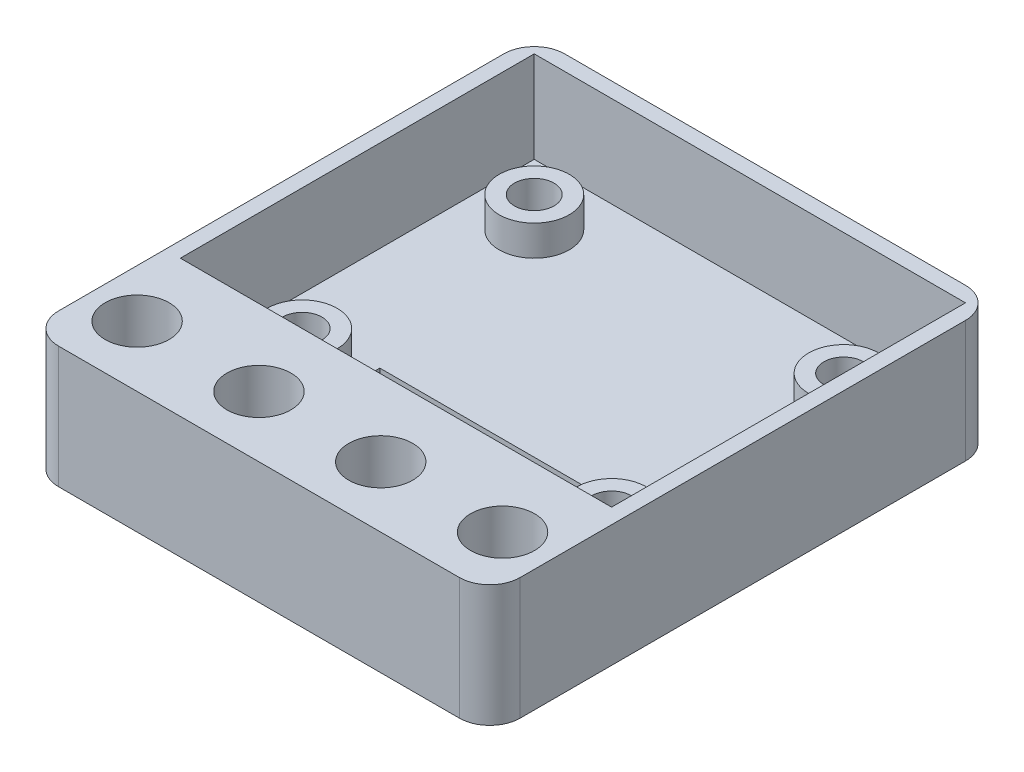
from build123d import *

# Parameters (mm, degrees)
SKETCH1_W           = 28.32
SKETCH1_H           = 23.24
SKETCH1_R           = 2.3
SKETCH1_W_2         = 14.72
SKETCH1_H_2         = 4.6
BOSS_EXTRUDE1_DEPTH = 2
SKETCH1_3_R         = 2.3
SKETCH1_3_R_2       = 1.3
BOSS_EXTRUDE2_DEPTH = 4
SKETCH1_4_R         = 2.1
SKETCH1_4_W         = 28.32
SKETCH1_4_H         = 23.24
BOSS_EXTRUDE3_DEPTH = 8
FILLET2_R           = 2


with BuildPart() as part:
    # Sketch1 → Boss-Extrude1 (new body)
    with BuildSketch(Plane(origin=(0, 0, 0), x_dir=(1, 0, 0), z_dir=(0, 1, 0))):
        Rectangle(SKETCH1_W, SKETCH1_H)
        with Locations((-10.16, -7.62)):
            Circle(SKETCH1_R, mode=Mode.SUBTRACT)
        with Locations((0, -7.62)):
            Rectangle(SKETCH1_W_2, SKETCH1_H_2, mode=Mode.SUBTRACT)
        with Locations((10.16, -7.62)):
            Circle(SKETCH1_R, mode=Mode.SUBTRACT)
        with Locations((-10.16, 7.62)):
            Circle(SKETCH1_R, mode=Mode.SUBTRACT)
        with Locations((10.16, 7.62)):
            Circle(SKETCH1_R, mode=Mode.SUBTRACT)
    extrude(amount=BOSS_EXTRUDE1_DEPTH)

    # Sketch1<3> → Boss-Extrude2 (add)
    # profile 1 of 4: a face of its own
    with BuildSketch(Plane(origin=(0, 0, 0), x_dir=(1, 0, 0), z_dir=(0, 1, 0))):
        with Locations((-10.16, 7.62)):
            Circle(SKETCH1_3_R)
        with Locations((-10.16, 7.62)):
            Circle(SKETCH1_3_R_2, mode=Mode.SUBTRACT)
    # profile 2 of 4: a face of its own
    with BuildSketch(Plane(origin=(0, 0, 0), x_dir=(1, 0, 0), z_dir=(0, 1, 0))):
        with Locations((-10.16, -7.62)):
            Circle(SKETCH1_3_R)
        with Locations((-10.16, -7.62)):
            Circle(SKETCH1_3_R_2, mode=Mode.SUBTRACT)
    # profile 3 of 4: a face of its own
    with BuildSketch(Plane(origin=(0, 0, 0), x_dir=(1, 0, 0), z_dir=(0, 1, 0))):
        with Locations((10.16, 7.62)):
            Circle(SKETCH1_3_R)
        with Locations((10.16, 7.62)):
            Circle(SKETCH1_3_R_2, mode=Mode.SUBTRACT)
    # profile 4 of 4: a face of its own
    with BuildSketch(Plane(origin=(0, 0, 0), x_dir=(1, 0, 0), z_dir=(0, 1, 0))):
        with Locations((10.16, -7.62)):
            Circle(SKETCH1_3_R)
        with Locations((10.16, -7.62)):
            Circle(SKETCH1_3_R_2, mode=Mode.SUBTRACT)
    extrude(amount=BOSS_EXTRUDE2_DEPTH)

    # Sketch1<4> → Boss-Extrude3 (add)
    with BuildSketch(Plane(origin=(0, 0, 0), x_dir=(1, 0, 0), z_dir=(0, 1, 0))):
        Polygon((15.16, -12.62), (15.16, 12.62), (-15.16, 12.62), (-15.16, -12.62), (-15.16, -20.62), (15.16, -20.62), align=None)
        with Locations((-12, -16.62)):
            Circle(SKETCH1_4_R, mode=Mode.SUBTRACT)
        with Locations((-4, -16.62)):
            Circle(SKETCH1_4_R, mode=Mode.SUBTRACT)
        with Locations((4, -16.62)):
            Circle(SKETCH1_4_R, mode=Mode.SUBTRACT)
        with Locations((12, -16.62)):
            Circle(SKETCH1_4_R, mode=Mode.SUBTRACT)
        Rectangle(SKETCH1_4_W, SKETCH1_4_H, mode=Mode.SUBTRACT)
    extrude(amount=BOSS_EXTRUDE3_DEPTH)

    # Fillet2
    fillet2_edges = [part.edges().sort_by_distance(p)[0] for p in [
        (15.16, 4, 20.62),
        (15.16, 4, -12.62),
        (-15.16, 4, -12.62),
        (-15.16, 4, 20.62),
    ]]
    fillet(fillet2_edges, radius=FILLET2_R)


solid = part.part
